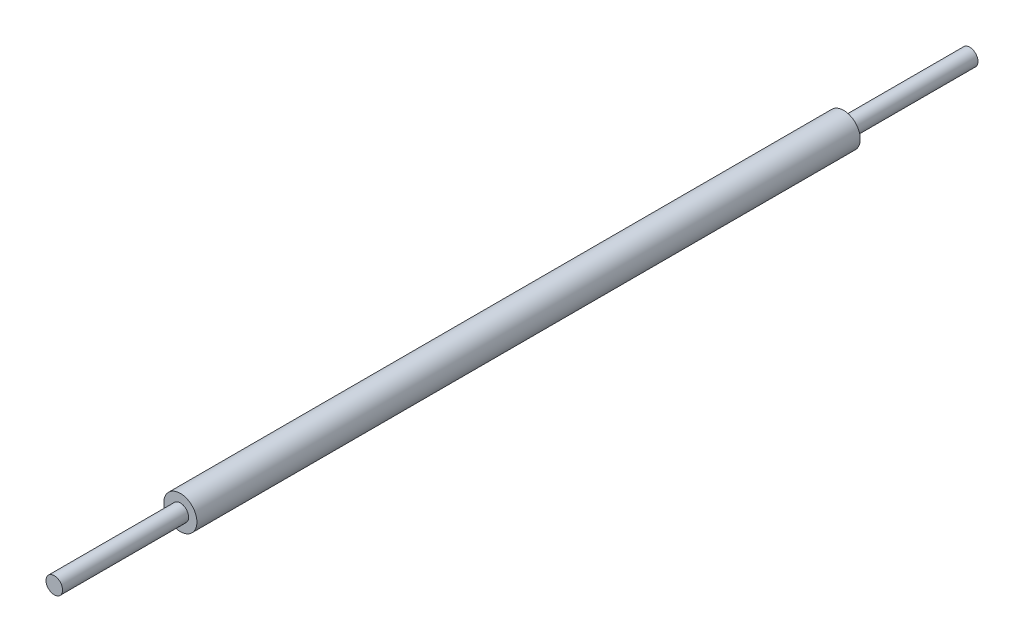
from build123d import *

# Parameters (mm, degrees)
SKETCH2_R           = 6.35
BOSS_EXTRUDE2_DEPTH = 96.52
SKETCH7_R           = 12.7
BOSS_EXTRUDE3_DEPTH = 508
SKETCH13_R          = 6.35
BOSS_EXTRUDE4_DEPTH = 96.52


with BuildPart() as part:
    # Sketch2 → Boss-Extrude2 (new body)
    with BuildSketch(Plane.XY):
        Circle(SKETCH2_R)
    extrude(amount=BOSS_EXTRUDE2_DEPTH)

    # Sketch7 → Boss-Extrude3 (add)
    with BuildSketch(Plane.XY.offset(96.52)):
        Circle(SKETCH7_R)
    extrude(amount=BOSS_EXTRUDE3_DEPTH)

    # Sketch13 → Boss-Extrude4 (add)
    with BuildSketch(Plane.XY.offset(604.52)):
        Circle(SKETCH13_R)
    extrude(amount=BOSS_EXTRUDE4_DEPTH)


solid = part.part
